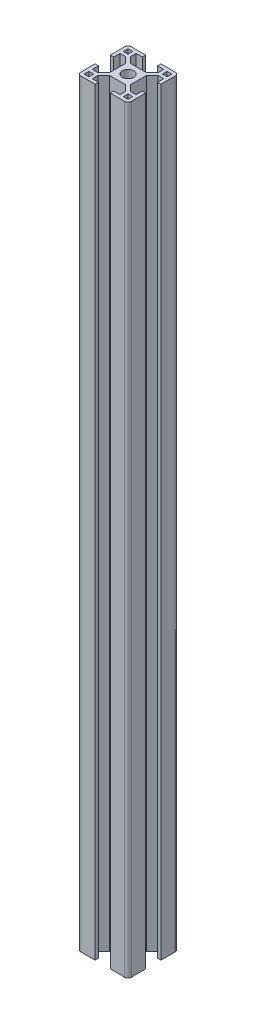
from build123d import *

# Parameters (mm, degrees)
SKETCH1_W      = 20
SKETCH1_H      = 20
EXTRUDE1_DEPTH = 300
SKETCH2_R      = 2.266666667
SKETCH2_W      = 1.866666667
SKETCH2_H      = 1.866666667
EXTRUDE2_DEPTH = 301.333148354
FILLET1_R      = 1.333333333


with BuildPart() as part:
    # Sketch1 → Extrude1 (new body)
    with BuildSketch(Plane(origin=(0, 0, 0), x_dir=(1, 0, 0), z_dir=(0, 1, 0))):
        Rectangle(SKETCH1_W, SKETCH1_H)
    extrude(amount=EXTRUDE1_DEPTH)

    # Sketch2 → Extrude2 (cut, through all)
    with BuildSketch(Plane(origin=(0, 300, 0), x_dir=(1, 0, 0), z_dir=(0, 1, 0))):
        Circle(SKETCH2_R)
        Polygon((8.666666667, 3), (11.333333333, 3), (11.333333333, -3), (8.666666667, -3), (8.666666667, -5.466666667), (6.409475708, -5.466666667), (4.133333333, -3.190524292), (4.133333333, 3.190524292), (6.409475708, 5.466666667), (8.666666667, 5.466666667), align=None)
        with Locations((7.733333334, 7.733333334)):
            Rectangle(SKETCH2_W, SKETCH2_H)
        Polygon((-3.190524292, 4.133333333), (-5.466666667, 6.409475708), (-5.466666667, 8.666666667), (-3, 8.666666667), (-3, 11.333333333), (3, 11.333333333), (3, 8.666666667), (5.466666667, 8.666666667), (5.466666667, 6.409475708), (3.190524292, 4.133333333), align=None)
        with Locations((7.733333334, -7.733333334)):
            Rectangle(SKETCH2_W, SKETCH2_H)
        with Locations((-7.733333334, 7.733333334)):
            Rectangle(SKETCH2_W, SKETCH2_H)
        with Locations((-7.733333334, -7.733333334)):
            Rectangle(SKETCH2_W, SKETCH2_H)
        Polygon((-6.409475708, -5.466666667), (-8.666666667, -5.466666667), (-8.666666667, -3), (-11.333333333, -3), (-11.333333333, 3), (-8.666666667, 3), (-8.666666667, 5.466666667), (-6.409475708, 5.466666667), (-4.133333333, 3.190524292), (-4.133333333, -3.190524292), align=None)
        Polygon((3.190524292, -4.133333333), (-3.190524292, -4.133333333), (-5.466666667, -6.409475708), (-5.466666667, -8.666666667), (-3, -8.666666667), (-3, -11.333333333), (3, -11.333333333), (3, -8.666666667), (5.466666667, -8.666666667), (5.466666667, -6.409475708), align=None)
    extrude(amount=-EXTRUDE2_DEPTH, mode=Mode.SUBTRACT)

    # Fillet1
    fillet1_edges = [part.edges().sort_by_distance(p)[0] for p in [
        (10, 150, 10),
        (10, 150, -10),
        (-10, 150, 10),
        (-10, 150, -10),
    ]]
    fillet(fillet1_edges, radius=FILLET1_R)


solid = part.part
